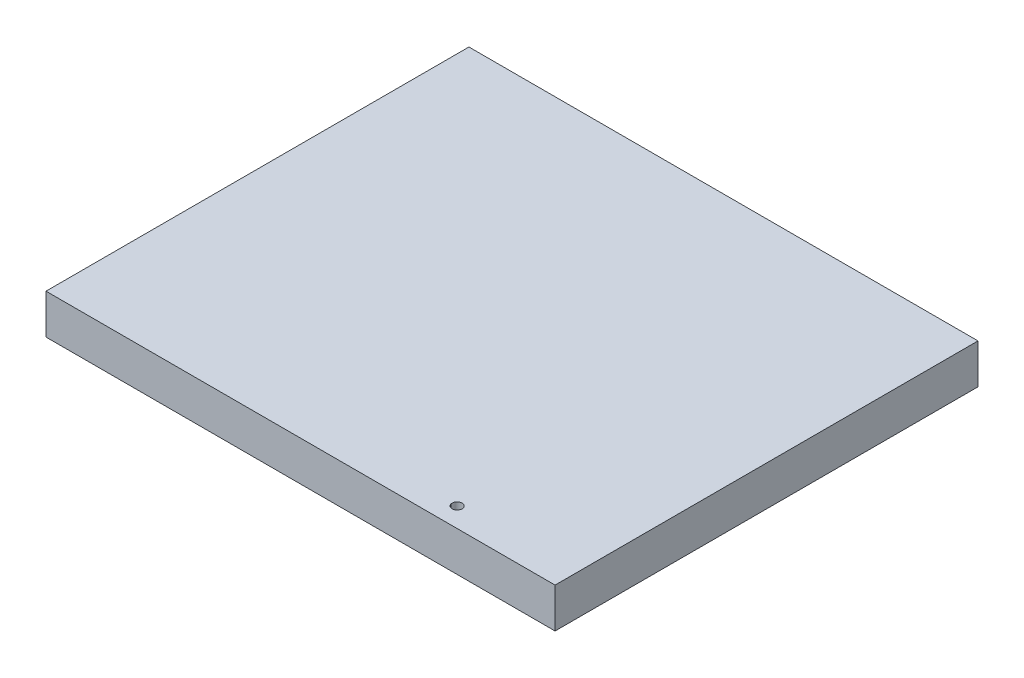
from build123d import *

# Parameters (mm, degrees)
SKETCH2_W           = 325
SKETCH2_H           = 270
BOSS_EXTRUDE1_DEPTH = 25.4
SKETCH5_R           = 3.2
CUT_EXTRUDE2_DEPTH  = 25.4


with BuildPart() as part:
    # Sketch2 → Boss-Extrude1 (new body)
    with BuildSketch(Plane(origin=(0, 0, 0), x_dir=(1, 0, 0), z_dir=(0, 1, 0))):
        with Locations((16.705601256, -25.116377771)):
            Rectangle(SKETCH2_W, SKETCH2_H)
    extrude(amount=BOSS_EXTRUDE1_DEPTH)

    # Sketch5 → Cut-Extrude2 (cut)
    with BuildSketch(Plane(origin=(0, 25.4, 0), x_dir=(1, 0, 0), z_dir=(0, 1, 0))):
        with Locations(Location((104.205601256, -147.616377771, 0), (0, 0, 270))):
            Circle(SKETCH5_R)
    extrude(amount=-CUT_EXTRUDE2_DEPTH, mode=Mode.SUBTRACT)


solid = part.part
